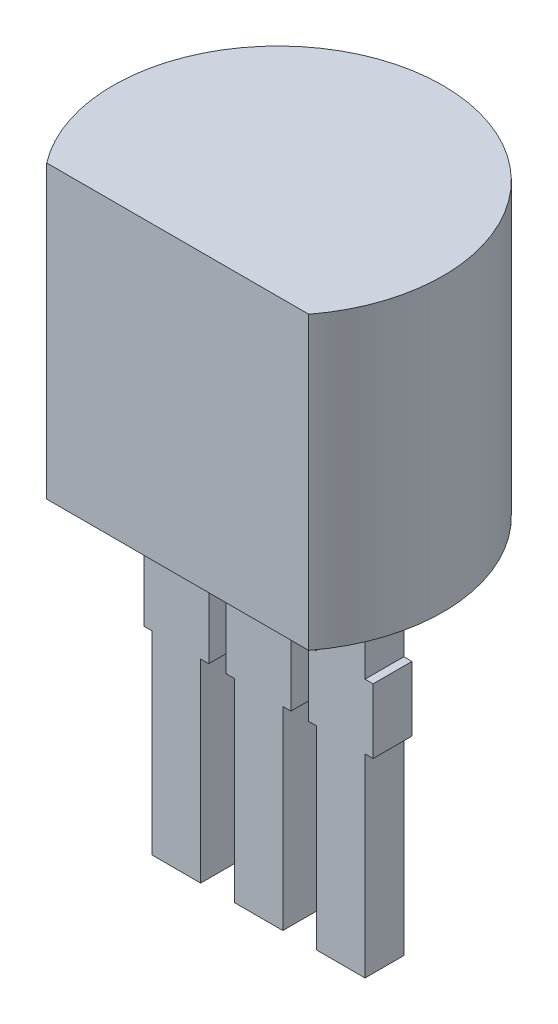
from build123d import *

# Parameters (mm, degrees)
EXTRUDE_1_DEPTH = 4.5
EXTRUDE_2_DEPTH = 0.3


with BuildPart() as part:
    # Эскиз1 → Бобышка-Вытянуть1 (new body)
    with BuildSketch(Plane(origin=(0, 0, 0), x_dir=(1, 0, 0), z_dir=(0, 1, 0))):
        with BuildLine():
            Line((-2.024845673, -1.55), (2.024845673, -1.55))
            ThreePointArc((2.024845673, -1.55), (0, 2.55), (-2.024845673, -1.55))
        make_face()
    extrude(amount=EXTRUDE_1_DEPTH)

    # Эскиз3 → Бобышка-Вытянуть2 (add, symmetric)
    with BuildSketch(Plane.XY):
        Polygon((-0.375, 0), (0.375, 0), (0.375, -1.2), (0.5, -1.2), (0.5, -2.2), (0.375, -2.2), (0.375, -5.2), (-0.375, -5.2), (-0.375, -2.2), (-0.5, -2.2), (-0.5, -1.2), (-0.375, -1.2), align=None)
        Polygon((0.895, 0), (1.645, 0), (1.645, -1.2), (1.77, -1.2), (1.77, -2.2), (1.645, -2.2), (1.645, -5.2), (0.895, -5.2), (0.895, -2.2), (0.77, -2.2), (0.77, -1.2), (0.895, -1.2), align=None)
        Polygon((-1.77, -1.2), (-1.77, -2.2), (-1.645, -2.2), (-1.645, -5.2), (-0.895, -5.2), (-0.895, -2.2), (-0.77, -2.2), (-0.77, -1.2), (-0.895, -1.2), (-0.895, 0), (-1.645, 0), (-1.645, -1.2), align=None)
    extrude(amount=EXTRUDE_2_DEPTH, both=True)


solid = part.part
